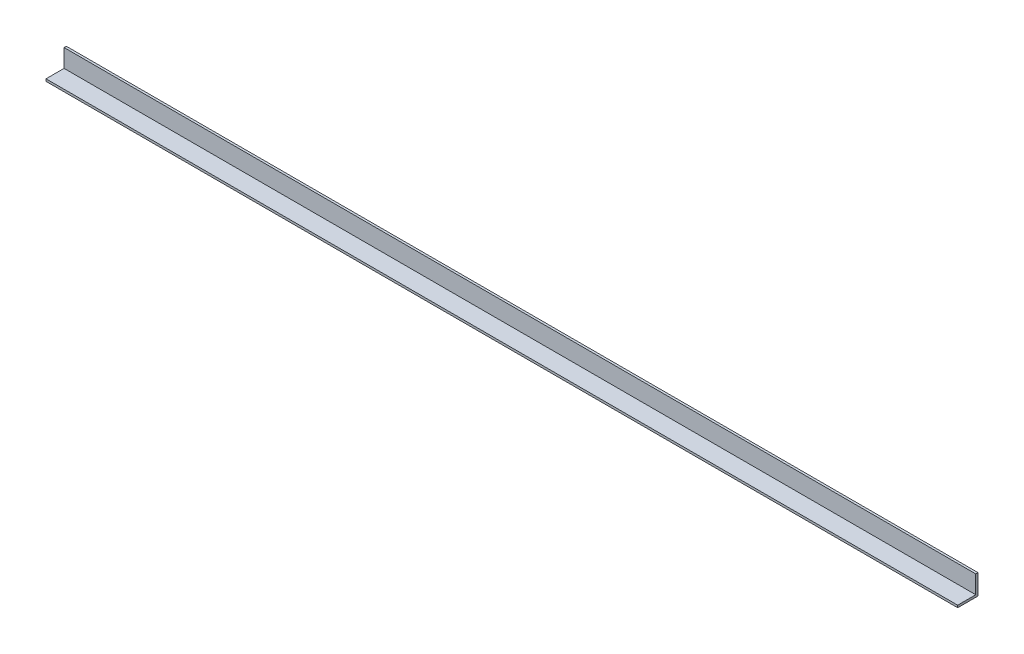
from build123d import *

# Parameters (mm, degrees)
SKETCH1_W           = 1010
SKETCH1_H           = 22.5
BOSS_EXTRUDE1_DEPTH = 2.5
SKETCH2_W           = 1010
SKETCH2_H           = 2.5
BOSS_EXTRUDE2_DEPTH = 20


with BuildPart() as part:
    # Sketch1 → Boss-Extrude1 (new body)
    with BuildSketch(Plane(origin=(0, 0, 0), x_dir=(1, 0, 0), z_dir=(0, 1, 0))):
        Rectangle(SKETCH1_W, SKETCH1_H)
    extrude(amount=BOSS_EXTRUDE1_DEPTH)

    # Sketch2 → Boss-Extrude2 (add)
    with BuildSketch(Plane(origin=(0, 2.5, 0), x_dir=(1, 0, 0), z_dir=(0, 1, 0))):
        with Locations((0, 10)):
            Rectangle(SKETCH2_W, SKETCH2_H)
    extrude(amount=BOSS_EXTRUDE2_DEPTH)


solid = part.part
